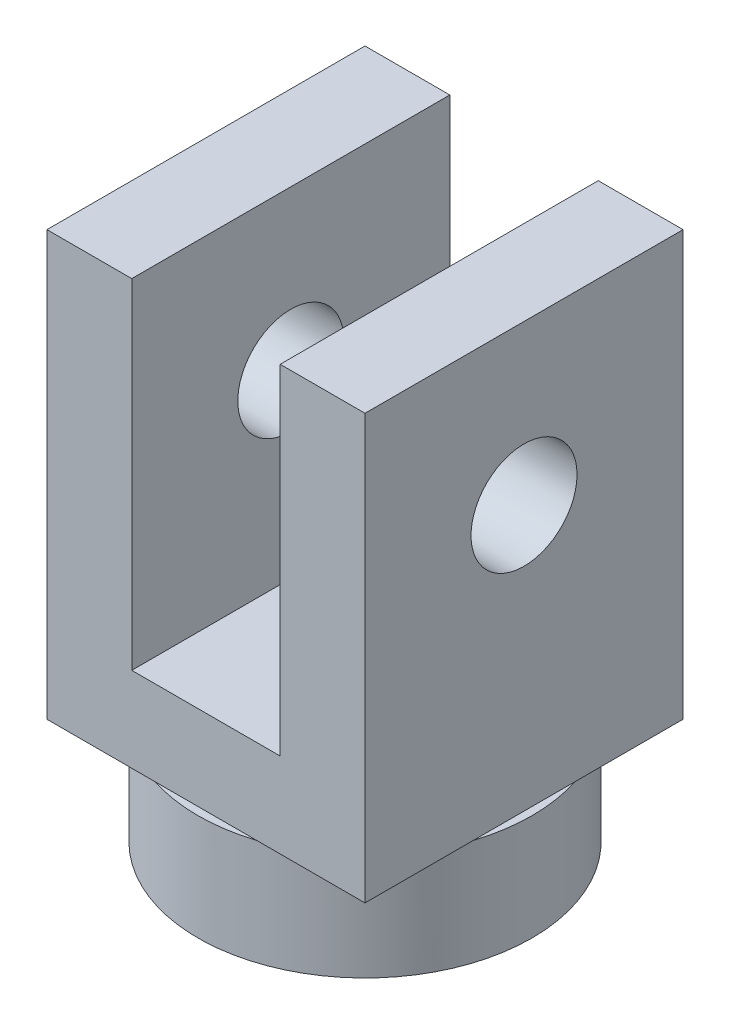
from build123d import *

# Parameters (mm, degrees)
BOSS_EXTRUDE1_DEPTH = 9.525
SKETCH2_R           = 10
BOSS_EXTRUDE2_DEPTH = 6.35
CUT_EXTRUDE1_REACH  = 36.757
SKETCH3_R           = 3.175
SKETCH4_R           = 3.175
CUT_EXTRUDE2_DEPTH  = 30.053883131


with BuildPart() as part:
    # Sketch1 → Boss-Extrude1 (new, symmetric)
    with BuildSketch(Plane.XY):
        Polygon((-9.525, 12.7), (-9.525, -12.7), (9.525, -12.7), (9.525, 12.7), (4.445, 12.7), (4.445, -7.62), (-4.445, -7.62), (-4.445, 12.7), align=None)
    extrude(amount=BOSS_EXTRUDE1_DEPTH, both=True)

    # Sketch2 → Boss-Extrude2 (add)
    with BuildSketch(Plane.XZ.offset(12.7)):
        Circle(SKETCH2_R)
    extrude(amount=BOSS_EXTRUDE2_DEPTH)

    # Sketch3 → Cut-Extrude1 (cut, up to next)
    with BuildSketch(Plane.XZ.offset(19.05), mode=Mode.PRIVATE) as cut_extrude1_sk1:
        Circle(SKETCH3_R)
    cut_extrude1_tool1 = extrude(cut_extrude1_sk1.sketch, amount=-CUT_EXTRUDE1_REACH, mode=Mode.PRIVATE) & part.part
    add(cut_extrude1_tool1.solids().sort_by_distance((0, -19.05, 0))[0], mode=Mode.SUBTRACT)

    # Sketch4 → Cut-Extrude2 (cut, through all)
    with BuildSketch(Plane(origin=(9.525, 0, 0), x_dir=(0, 0, -1), z_dir=(1, 0, 0))):
        with Locations((0, 3.175)):
            Circle(SKETCH4_R)
    extrude(amount=-CUT_EXTRUDE2_DEPTH, mode=Mode.SUBTRACT)


solid = part.part
